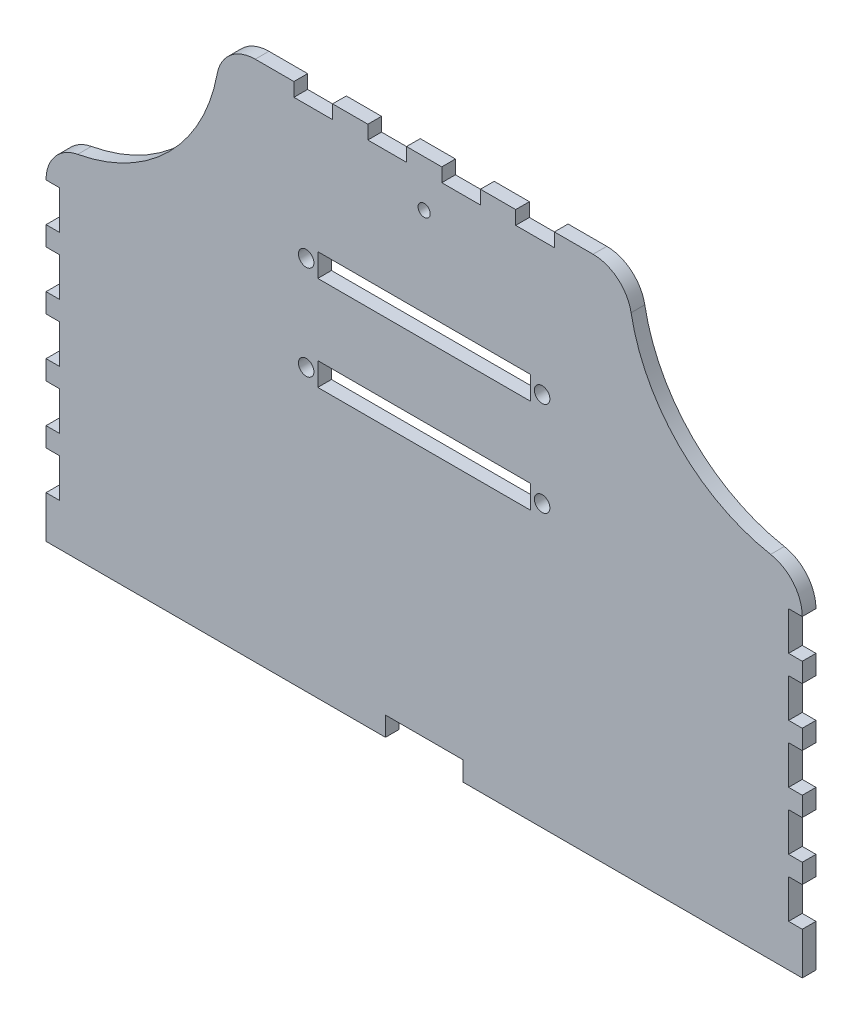
from build123d import *

# Parameters (mm, degrees)
BOSS_EXTRUDE1_DEPTH = 4.4958
FILLET1_R           = 12.7
SKETCH2_W           = 4.4958
SKETCH2_H           = 12.7
CUT_EXTRUDE1_DEPTH  = 302.762747772
SKETCH3_W           = 12.7
SKETCH3_H           = 4.4958
CUT_EXTRUDE2_DEPTH  = 302.762747772
SKETCH5_W           = 25.4
SKETCH5_H           = 6.35
CUT_EXTRUDE4_DEPTH  = 302.762747772
SKETCH7_R           = 2.54
SKETCH7_W           = 69.85
SKETCH7_H           = 7.62
CUT_EXTRUDE6_DEPTH  = 302.762747772
SKETCH8_R           = 2
CUT_EXTRUDE7_DEPTH  = 302.762747772


with BuildPart() as part:
    # Sketch1 → Boss-Extrude1 (new body)
    with BuildSketch(Plane.XY):
        with BuildLine():
            Line((0, 114.3), (0, 0))
            Line((0, 0), (248.285, 0))
            Line((248.285, 0), (248.285, 114.3))
            ThreePointArc((248.285, 114.3), (207.873847455, 131.038847455), (191.135, 171.45))
            Line((191.135, 171.45), (57.15, 171.45))
            ThreePointArc((57.15, 171.45), (40.411152545, 131.038847455), (0, 114.3))
        make_face()
    extrude(amount=BOSS_EXTRUDE1_DEPTH)

    # Fillet1
    fillet1_edges = [part.edges().sort_by_distance(p)[0] for p in [
        (248.285, 114.3, 2.2479),
        (0, 114.3, 2.2479),
        (57.15, 171.45, 2.2479),
        (191.135, 171.45, 2.2479),
    ]]
    fillet(fillet1_edges, radius=FILLET1_R)

    # Sketch2 → Cut-Extrude1 (cut, through all)
    with BuildSketch(Plane.XY.offset(4.4958)):
        with Locations((246.0371, 96.414248202)):
            Rectangle(SKETCH2_W, SKETCH2_H)
        with Locations((246.0371, 77.364248202)):
            Rectangle(SKETCH2_W, SKETCH2_H)
        with Locations((246.0371, 39.264248202)):
            Rectangle(SKETCH2_W, SKETCH2_H)
        with Locations((246.0371, 58.314248202)):
            Rectangle(SKETCH2_W, SKETCH2_H)
        with Locations((246.0371, 20.214248202)):
            Rectangle(SKETCH2_W, SKETCH2_H)
        with Locations((2.2479, 96.414248202)):
            Rectangle(SKETCH2_W, SKETCH2_H)
        with Locations((2.2479, 77.364248202)):
            Rectangle(SKETCH2_W, SKETCH2_H)
        with Locations((2.2479, 58.314248202)):
            Rectangle(SKETCH2_W, SKETCH2_H)
        with Locations((2.2479, 39.264248202)):
            Rectangle(SKETCH2_W, SKETCH2_H)
        with Locations((2.2479, 20.214248202)):
            Rectangle(SKETCH2_W, SKETCH2_H)
    extrude(amount=-CUT_EXTRUDE1_DEPTH, mode=Mode.SUBTRACT)

    # Sketch3 → Cut-Extrude2 (cut, through all)
    with BuildSketch(Plane.XY.offset(4.4958)):
        with Locations((112.006917266, 169.2021)):
            Rectangle(SKETCH3_W, SKETCH3_H)
        with Locations((87.735751798, 169.2021)):
            Rectangle(SKETCH3_W, SKETCH3_H)
        with Locations((136.278082734, 169.2021)):
            Rectangle(SKETCH3_W, SKETCH3_H)
        with Locations((160.549248202, 169.2021)):
            Rectangle(SKETCH3_W, SKETCH3_H)
    extrude(amount=-CUT_EXTRUDE2_DEPTH, mode=Mode.SUBTRACT)

    # Sketch5 → Cut-Extrude4 (cut, through all)
    with BuildSketch(Plane.XY.offset(4.4958)):
        with Locations((124.1425, 3.175)):
            Rectangle(SKETCH5_W, SKETCH5_H)
    extrude(amount=-CUT_EXTRUDE4_DEPTH, mode=Mode.SUBTRACT)

    # Sketch7 → Cut-Extrude6 (cut, through all)
    with BuildSketch(Plane(origin=(0, 0, 0), x_dir=(-1, 0, 0), z_dir=(0, 0, -1))):
        with Locations((-85.4075, 123.19)):
            Circle(SKETCH7_R)
        with Locations((-162.8775, 123.19)):
            Circle(SKETCH7_R)
        with Locations((-124.1425, 123.19)):
            Rectangle(SKETCH7_W, SKETCH7_H)
        with Locations((-124.1425, 92.202)):
            Rectangle(SKETCH7_W, SKETCH7_H)
        with Locations((-85.4075, 92.202)):
            Circle(SKETCH7_R)
        with Locations((-162.8775, 92.202)):
            Circle(SKETCH7_R)
    extrude(amount=-CUT_EXTRUDE6_DEPTH, mode=Mode.SUBTRACT)

    # Sketch8 → Cut-Extrude7 (cut, through all)
    with BuildSketch(Plane(origin=(0, 0, 0), x_dir=(-1, 0, 0), z_dir=(0, 0, -1))):
        with Locations((-124.1425, 156.21)):
            Circle(SKETCH8_R)
    extrude(amount=-CUT_EXTRUDE7_DEPTH, mode=Mode.SUBTRACT)


solid = part.part
